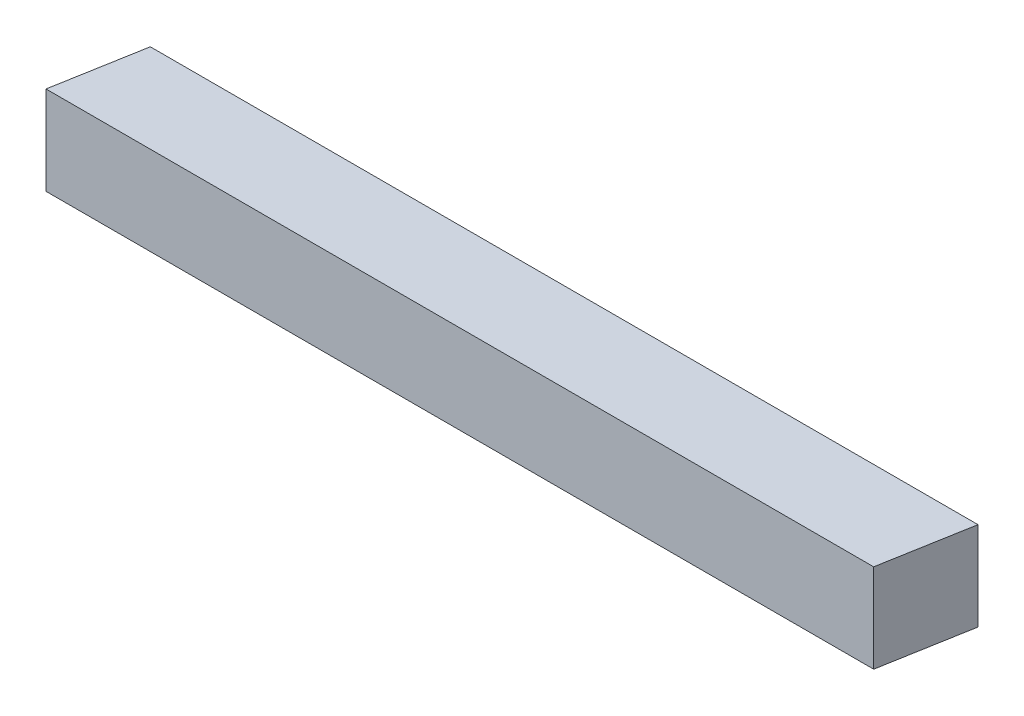
from build123d import *

# Parameters (mm, degrees)
BOSS_EXTRUDE1_DEPTH = 19.05


with BuildPart() as part:
    # Sketch1 → Boss-Extrude1 (new body)
    with BuildSketch(Plane(origin=(0, 0, 0), x_dir=(1, 0, 0), z_dir=(0, 1, 0))):
        Polygon((143.702197952, -41.593316195), (-34.097802048, -41.593316195), (-30.738773066, -22.543316195), (147.061226934, -22.543316195), align=None)
    extrude(amount=BOSS_EXTRUDE1_DEPTH)


solid = part.part
